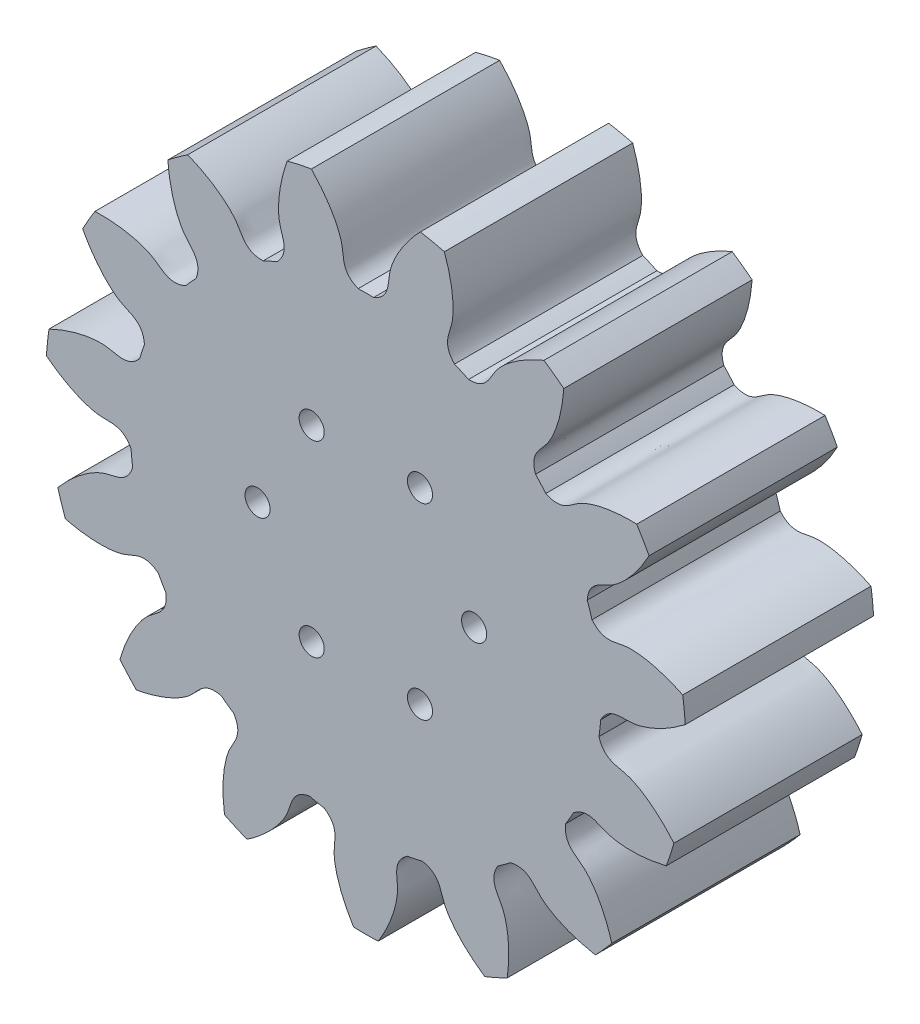
from build123d import *

# Parameters (mm, degrees)
SKETCH_1_R               = 51
EXTRUDE_1_DEPTH          = 30
CUT_EXTRUDE_1_DEPTH      = 79.115299398
PATTERN_CIRCULAR_1_COUNT = 15
SKETCH_4_R               = 2
CUT_EXTRUDE_3_DEPTH      = 70


with BuildPart() as part:
    # 草图1 → 凸台-拉伸1 (new body)
    with BuildSketch(Plane.XY):
        Circle(SKETCH_1_R)
    extrude(amount=EXTRUDE_1_DEPTH)

    # 草图2 → 切除-拉伸1 (cut, through all)
    with BuildSketch(Plane.XY):
        with BuildLine():
            ThreePointArc((1.225710247, 37.479963106), (0, 37.5), (-1.225710247, 37.479963106))
            add(Edge.make_bspline(
                [(-1.225710247, 37.479963106), (-3.943278351, 38.606461371), (-3.432678804, 40.717976536), (-3.90756292, 42.651022591), (-3.944599073, 42.789949778), (-3.989093085, 42.944362941), (-4.041661425, 43.114015827), (-4.102934406, 43.298639853), (-4.173528182, 43.497948585), (-4.254052818, 43.711636599), (-4.345109152, 43.939380103), (-4.447289105, 44.180837039), (-4.561174948, 44.43564736), (-4.687338895, 44.703433261), (-4.826342603, 44.983799451), (-4.978736707, 45.276333424), (-5.145060363, 45.58060574), (-5.325840781, 45.896170327), (-5.521592789, 46.222564788), (-5.732818383, 46.559310716), (-5.960006297, 46.905914032), (-6.20363158, 47.261865319), (-6.464155177, 47.62664018), (-6.742023523, 47.999699595), (-7.037668143, 48.380490301), (-7.351505263, 48.768445167), (-7.683935429, 49.162983592), (-8.035343139, 49.563511905), (-8.406096478, 49.969423781), (-8.79654677, 50.380100653), (-9.207028237, 50.794912153), (-9.63785767, 51.213216542), (-10.089334109, 51.63436116), (-10.561738534, 52.057682884), (-11.055333569, 52.482508585), (-11.570363199, 52.908155606), (-12.10705249, 53.333932232), (-12.665607331, 53.759138183), (-13.246214181, 54.183065101), (-13.849039835, 54.60499705), (-14.47423119, 55.024211024), (-15.121915038, 55.439977451), (-15.792197858, 55.851560718), (-16.485165655, 56.258219682), (-17.20088365, 56.659208219), (-18.195513971, 57.190612221), (-18.960911481, 57.570203795), (-19.481030333, 57.815569238)],
                knots=[0, 0, 0, 0, 0.202473101, 0.206978902, 0.212085478, 0.217792827, 0.224100949, 0.231009845, 0.238519514, 0.246629958, 0.255341174, 0.264653164, 0.274565928, 0.285079465, 0.296193776, 0.307908861, 0.320224719, 0.33314135, 0.346658755, 0.360776934, 0.375495886, 0.390815612, 0.406736111, 0.423257384, 0.440379431, 0.458102251, 0.476425844, 0.495350211, 0.514875352, 0.535001266, 0.555727954, 0.577055415, 0.59898365, 0.621512658, 0.64464244, 0.668372996, 0.692704325, 0.717636428, 0.743169304, 0.769302954, 0.796037377, 0.823372574, 0.851308544, 0.879845288, 0.908982806, 0.938721097, 1, 1, 1, 1], degree=3))
            ThreePointArc((-19.481030333, 57.815569238), (0, 61.00943033), (19.481030333, 57.815569238))
            add(Edge.make_bspline(
                [(1.225710247, 37.479963106), (3.943278351, 38.606461371), (3.432678804, 40.717976536), (3.90756292, 42.651022591), (3.944599073, 42.789949778), (3.989093085, 42.944362941), (4.041661425, 43.114015827), (4.102934406, 43.298639853), (4.173528182, 43.497948585), (4.254052818, 43.711636599), (4.345109152, 43.939380103), (4.447289105, 44.180837039), (4.561174948, 44.43564736), (4.687338895, 44.703433261), (4.826342603, 44.983799451), (4.978736707, 45.276333424), (5.145060363, 45.58060574), (5.325840781, 45.896170327), (5.521592789, 46.222564788), (5.732818383, 46.559310716), (5.960006297, 46.905914032), (6.20363158, 47.261865319), (6.464155177, 47.62664018), (6.742023523, 47.999699595), (7.037668143, 48.380490301), (7.351505263, 48.768445167), (7.683935429, 49.162983592), (8.035343139, 49.563511905), (8.406096478, 49.969423781), (8.79654677, 50.380100653), (9.207028237, 50.794912153), (9.63785767, 51.213216542), (10.089334109, 51.63436116), (10.561738534, 52.057682884), (11.055333569, 52.482508585), (11.570363199, 52.908155606), (12.10705249, 53.333932232), (12.665607331, 53.759138183), (13.246214181, 54.183065101), (13.849039835, 54.60499705), (14.47423119, 55.024211024), (15.121915038, 55.439977451), (15.792197858, 55.851560718), (16.485165655, 56.258219682), (17.20088365, 56.659208219), (18.195513971, 57.190612221), (18.960911481, 57.570203795), (19.481030333, 57.815569238)],
                knots=[0, 0, 0, 0, 0.202473101, 0.206978902, 0.212085478, 0.217792827, 0.224100949, 0.231009845, 0.238519514, 0.246629958, 0.255341174, 0.264653164, 0.274565928, 0.285079465, 0.296193776, 0.307908861, 0.320224719, 0.33314135, 0.346658755, 0.360776934, 0.375495886, 0.390815612, 0.406736111, 0.423257384, 0.440379431, 0.458102251, 0.476425844, 0.495350211, 0.514875352, 0.535001266, 0.555727954, 0.577055415, 0.59898365, 0.621512658, 0.64464244, 0.668372996, 0.692704325, 0.717636428, 0.743169304, 0.769302954, 0.796037377, 0.823372574, 0.851308544, 0.879845288, 0.908982806, 0.938721097, 1, 1, 1, 1], degree=3))
        make_face()
    cut_extrude_1 = extrude(amount=CUT_EXTRUDE_1_DEPTH, mode=Mode.SUBTRACT)

    # 阵列(圆周)1: 切除-拉伸1 ×15 about axis
    pattern_circular_1_axis = Axis((0, 0, -1.5), (0, 0, 1))
    for i in range(1, PATTERN_CIRCULAR_1_COUNT):
        add(cut_extrude_1.rotate(pattern_circular_1_axis, i * 360 / PATTERN_CIRCULAR_1_COUNT), mode=Mode.SUBTRACT)

    # 草图4 → 切除-拉伸3 (cut)
    with BuildSketch(Plane(origin=(0, 0, 0), x_dir=(-1, 0, 0), z_dir=(0, 0, -1))):
        with Locations((-17.25, 0)):
            Circle(SKETCH_4_R)
        with Locations((-8.625, 14.938938215)):
            Circle(SKETCH_4_R)
        with Locations((8.625, 14.938938215)):
            Circle(SKETCH_4_R)
        with Locations((17.25, 0)):
            Circle(SKETCH_4_R)
        with Locations((8.625, -14.938938215)):
            Circle(SKETCH_4_R)
        with Locations((-8.625, -14.938938215)):
            Circle(SKETCH_4_R)
    extrude(amount=-CUT_EXTRUDE_3_DEPTH, mode=Mode.SUBTRACT)


solid = part.part
